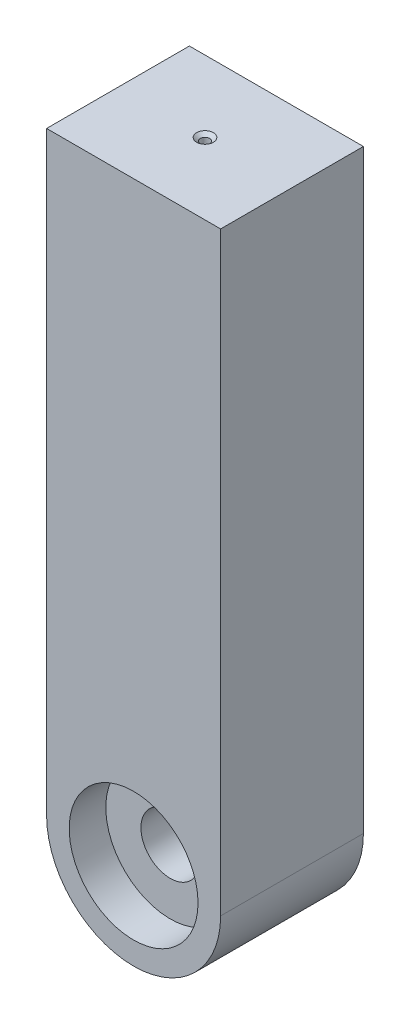
from build123d import *

# Parameters (mm, degrees)
BOSS_EXTRUDE1_DEPTH                   = 24.384
F_1_16_0_0625_DOWEL_HOLE1_D           = 1.5875
F_1_16_0_0625_DOWEL_HOLE1_CSINK_D     = 2.8575
F_1_16_0_0625_DOWEL_HOLE1_CSINK_ANGLE = 100
SKETCH7_R                             = 11
CUT_EXTRUDE1_DEPTH                    = 6.25
SKETCH8_R                             = 5
CUT_EXTRUDE2_DEPTH                    = 33


with BuildPart() as part:
    # Sketch1 → Boss-Extrude1 (new body)
    with BuildSketch(Plane.XY):
        with BuildLine():
            Line((-14.859, 0), (-14.859, 101.6))
            Line((-14.859, 101.6), (14.859, 101.6))
            Line((14.859, 101.6), (14.859, 0))
            ThreePointArc((14.859, 0), (0, -14.859), (-14.859, 0))
        make_face()
    extrude(amount=BOSS_EXTRUDE1_DEPTH)

    # 1/16 (0.0625) Dowel Hole1 (through all)
    with Locations(Plane(origin=(0, 101.6, 0), x_dir=(1, 0, 0), z_dir=(0, 1, 0))):
        with Locations((0, -12.192)):
            CounterSinkHole(F_1_16_0_0625_DOWEL_HOLE1_D / 2, F_1_16_0_0625_DOWEL_HOLE1_CSINK_D / 2, counter_sink_angle=F_1_16_0_0625_DOWEL_HOLE1_CSINK_ANGLE)

    # Sketch7 → Cut-Extrude1 (cut)
    with BuildSketch(Plane.XY.offset(24.384)):
        Circle(SKETCH7_R)
    extrude(amount=-CUT_EXTRUDE1_DEPTH, mode=Mode.SUBTRACT)

    # Sketch8 → Cut-Extrude2 (cut)
    with BuildSketch(Plane.XY.offset(18.134)):
        Circle(SKETCH8_R)
    extrude(amount=-CUT_EXTRUDE2_DEPTH, mode=Mode.SUBTRACT)


solid = part.part
